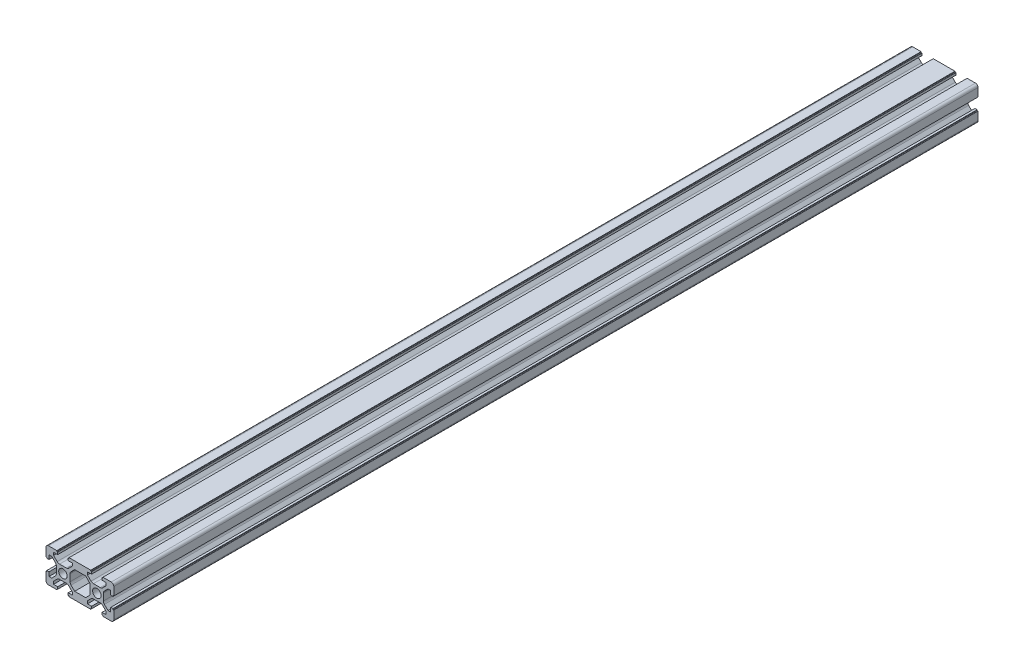
from build123d import *

# Parameters (mm, degrees)
SKETCH1_R               = 2.5
EXTRUDE1_DEPTH          = 510
CUT_EXTRUDE1_DEPTH      = 511.979451642
CUT_EXTRUDE1_DEPTH_BACK = 511.979451642
SKETCH2_W               = 3.3
SKETCH2_H               = 11.078679656


with BuildPart() as part:
    # Sketch1 → Extrude1 (new body)
    with BuildSketch(Plane.XY):
        with BuildLine():
            Line((0, 3.9), (-2.010912703, 3.9))
            ThreePointArc((-2.010912703, 3.9), (-2.776279568, 4.052240935), (-3.425126266, 4.485786438))
            Line((-3.425126266, 4.485786438), (-5.539339828, 6.6))
            Line((-5.539339828, 6.6), (-5.539339828, 8.2))
            Line((-5.539339828, 8.2), (-3.1, 8.2))
            Line((-3.1, 8.2), (-3.1, 9.5))
            Line((-3.1, 9.5), (-3.4, 9.5))
            ThreePointArc((-3.4, 9.5), (-3.541421356, 9.558578644), (-3.6, 9.7))
            Line((-3.6, 9.7), (-3.6, 10))
            Line((-3.6, 10), (-8.5, 10))
            Line((-8.5, 10), (-11.5, 10))
            Line((-11.5, 10), (-16.4, 10))
            Line((-16.4, 10), (-16.4, 9.7))
            ThreePointArc((-16.4, 9.7), (-16.458578644, 9.558578644), (-16.6, 9.5))
            Line((-16.6, 9.5), (-16.9, 9.5))
            Line((-16.9, 9.5), (-16.9, 8.2))
            Line((-16.9, 8.2), (-14.460660172, 8.2))
            Line((-14.460660172, 8.2), (-14.460660172, 6.6))
            Line((-14.460660172, 6.6), (-16.574873734, 4.485786438))
            ThreePointArc((-16.574873734, 4.485786438), (-17.223720432, 4.052240935), (-17.989087297, 3.9))
            Line((-17.989087297, 3.9), (-20, 3.9))
            Line((-20, 3.9), (-22.010912703, 3.9))
            ThreePointArc((-22.010912703, 3.9), (-22.776279568, 4.052240935), (-23.425126266, 4.485786438))
            Line((-23.425126266, 4.485786438), (-25.539339828, 6.6))
            Line((-25.539339828, 6.6), (-25.539339828, 8.2))
            Line((-25.539339828, 8.2), (-23.1, 8.2))
            Line((-23.1, 8.2), (-23.1, 9.5))
            Line((-23.1, 9.5), (-23.4, 9.5))
            ThreePointArc((-23.4, 9.5), (-23.541421356, 9.558578644), (-23.6, 9.7))
            Line((-23.6, 9.7), (-23.6, 10))
            Line((-23.6, 10), (-28.5, 10))
            ThreePointArc((-28.5, 10), (-29.560660172, 9.560660172), (-30, 8.5))
            Line((-30, 8.5), (-30, 3.6))
            Line((-30, 3.6), (-29.7, 3.6))
            ThreePointArc((-29.7, 3.6), (-29.558578644, 3.541421356), (-29.5, 3.4))
            Line((-29.5, 3.4), (-29.5, 3.1))
            Line((-29.5, 3.1), (-28.2, 3.1))
            Line((-28.2, 3.1), (-28.2, 5.539339828))
            Line((-28.2, 5.539339828), (-26.6, 5.539339828))
            Line((-26.6, 5.539339828), (-24.485786438, 3.425126266))
            ThreePointArc((-24.485786438, 3.425126266), (-24.052240935, 2.776279568), (-23.9, 2.010912703))
            Line((-23.9, 2.010912703), (-23.9, 0))
            Line((-23.9, 0), (-23.9, -2.010912703))
            ThreePointArc((-23.9, -2.010912703), (-24.052240935, -2.776279568), (-24.485786438, -3.425126266))
            Line((-24.485786438, -3.425126266), (-26.6, -5.539339828))
            Line((-26.6, -5.539339828), (-28.2, -5.539339828))
            Line((-28.2, -5.539339828), (-28.2, -3.1))
            Line((-28.2, -3.1), (-29.5, -3.1))
            Line((-29.5, -3.1), (-29.5, -3.4))
            ThreePointArc((-29.5, -3.4), (-29.558578644, -3.541421356), (-29.7, -3.6))
            Line((-29.7, -3.6), (-30, -3.6))
            Line((-30, -3.6), (-30, -8.5))
            ThreePointArc((-30, -8.5), (-29.560660172, -9.560660172), (-28.5, -10))
            Line((-28.5, -10), (-23.6, -10))
            Line((-23.6, -10), (-23.6, -9.7))
            ThreePointArc((-23.6, -9.7), (-23.541421356, -9.558578644), (-23.4, -9.5))
            Line((-23.4, -9.5), (-23.1, -9.5))
            Line((-23.1, -9.5), (-23.1, -8.2))
            Line((-23.1, -8.2), (-25.539339828, -8.2))
            Line((-25.539339828, -8.2), (-25.539339828, -6.6))
            Line((-25.539339828, -6.6), (-23.425126266, -4.485786438))
            ThreePointArc((-23.425126266, -4.485786438), (-22.776279568, -4.052240935), (-22.010912703, -3.9))
            Line((-22.010912703, -3.9), (-20, -3.9))
            Line((-20, -3.9), (-17.989087297, -3.9))
            ThreePointArc((-17.989087297, -3.9), (-17.223720432, -4.052240935), (-16.574873734, -4.485786438))
            Line((-16.574873734, -4.485786438), (-14.460660172, -6.6))
            Line((-14.460660172, -6.6), (-14.460660172, -8.2))
            Line((-14.460660172, -8.2), (-16.9, -8.2))
            Line((-16.9, -8.2), (-16.9, -9.5))
            Line((-16.9, -9.5), (-16.6, -9.5))
            ThreePointArc((-16.6, -9.5), (-16.458578644, -9.558578644), (-16.4, -9.7))
            Line((-16.4, -9.7), (-16.4, -10))
            Line((-16.4, -10), (-11.5, -10))
            Line((-11.5, -10), (-8.5, -10))
            Line((-8.5, -10), (-3.6, -10))
            Line((-3.6, -10), (-3.6, -9.7))
            ThreePointArc((-3.6, -9.7), (-3.541421356, -9.558578644), (-3.4, -9.5))
            Line((-3.4, -9.5), (-3.1, -9.5))
            Line((-3.1, -9.5), (-3.1, -8.2))
            Line((-3.1, -8.2), (-5.539339828, -8.2))
            Line((-5.539339828, -8.2), (-5.539339828, -6.6))
            Line((-5.539339828, -6.6), (-3.425126266, -4.485786438))
            ThreePointArc((-3.425126266, -4.485786438), (-2.776279568, -4.052240935), (-2.010912703, -3.9))
            Line((-2.010912703, -3.9), (0, -3.9))
            Line((0, -3.9), (2.010912703, -3.9))
            ThreePointArc((2.010912703, -3.9), (2.776279568, -4.052240935), (3.425126266, -4.485786438))
            Line((3.425126266, -4.485786438), (5.539339828, -6.6))
            Line((5.539339828, -6.6), (5.539339828, -8.2))
            Line((5.539339828, -8.2), (3.1, -8.2))
            Line((3.1, -8.2), (3.1, -9.5))
            Line((3.1, -9.5), (3.4, -9.5))
            ThreePointArc((3.4, -9.5), (3.541421356, -9.558578644), (3.6, -9.7))
            Line((3.6, -9.7), (3.6, -10))
            Line((3.6, -10), (8.5, -10))
            ThreePointArc((8.5, -10), (9.560660172, -9.560660172), (10, -8.5))
            Line((10, -8.5), (10, -3.6))
            Line((10, -3.6), (9.7, -3.6))
            ThreePointArc((9.7, -3.6), (9.558578644, -3.541421356), (9.5, -3.4))
            Line((9.5, -3.4), (9.5, -3.1))
            Line((9.5, -3.1), (8.2, -3.1))
            Line((8.2, -3.1), (8.2, -5.539339828))
            Line((8.2, -5.539339828), (6.6, -5.539339828))
            Line((6.6, -5.539339828), (4.485786438, -3.425126266))
            ThreePointArc((4.485786438, -3.425126266), (4.052240935, -2.776279568), (3.9, -2.010912703))
            Line((3.9, -2.010912703), (3.9, 0))
            Line((3.9, 0), (3.9, 2.010912703))
            ThreePointArc((3.9, 2.010912703), (4.052240935, 2.776279568), (4.485786438, 3.425126266))
            Line((4.485786438, 3.425126266), (6.6, 5.539339828))
            Line((6.6, 5.539339828), (8.2, 5.539339828))
            Line((8.2, 5.539339828), (8.2, 3.1))
            Line((8.2, 3.1), (9.5, 3.1))
            Line((9.5, 3.1), (9.5, 3.4))
            ThreePointArc((9.5, 3.4), (9.558578644, 3.541421356), (9.7, 3.6))
            Line((9.7, 3.6), (10, 3.6))
            Line((10, 3.6), (10, 8.5))
            ThreePointArc((10, 8.5), (9.560660172, 9.560660172), (8.5, 10))
            Line((8.5, 10), (3.6, 10))
            Line((3.6, 10), (3.6, 9.7))
            ThreePointArc((3.6, 9.7), (3.541421356, 9.558578644), (3.4, 9.5))
            Line((3.4, 9.5), (3.1, 9.5))
            Line((3.1, 9.5), (3.1, 8.2))
            Line((3.1, 8.2), (5.539339828, 8.2))
            Line((5.539339828, 8.2), (5.539339828, 6.6))
            Line((5.539339828, 6.6), (3.425126266, 4.485786438))
            ThreePointArc((3.425126266, 4.485786438), (2.776279568, 4.052240935), (2.010912703, 3.9))
            Line((2.010912703, 3.9), (0, 3.9))
        make_face()
        Circle(SKETCH1_R, mode=Mode.SUBTRACT)
        with Locations(Location((-20, 0, 0), (0, 0, 180))):
            Circle(SKETCH1_R, mode=Mode.SUBTRACT)
        with BuildLine():
            Line((-9.7, 3.6), (-10, 3.6))
            ThreePointArc((-10, 3.6), (-10.141421356, 3.541421356), (-10.2, 3.4))
            Line((-10.2, 3.4), (-10.2, 3.1))
            Line((-10.2, 3.1), (-11.5, 3.1))
            Line((-11.5, 3.1), (-11.5, 5.539339828))
            Line((-11.5, 5.539339828), (-13.1, 5.539339828))
            Line((-13.1, 5.539339828), (-15.214213562, 3.425126266))
            ThreePointArc((-15.214213562, 3.425126266), (-15.647759065, 2.776279568), (-15.8, 2.010912703))
            Line((-15.8, 2.010912703), (-15.8, 0))
            Line((-15.8, 0), (-15.8, -2.010912703))
            ThreePointArc((-15.8, -2.010912703), (-15.647759065, -2.776279568), (-15.214213562, -3.425126266))
            Line((-15.214213562, -3.425126266), (-13.1, -5.539339828))
            Line((-13.1, -5.539339828), (-11.5, -5.539339828))
            Line((-11.5, -5.539339828), (-11.5, -3.1))
            Line((-11.5, -3.1), (-10.2, -3.1))
            Line((-10.2, -3.1), (-10.2, -3.4))
            ThreePointArc((-10.2, -3.4), (-10.141421356, -3.541421356), (-10, -3.6))
            Line((-10, -3.6), (-9.7, -3.6))
            ThreePointArc((-9.7, -3.6), (-9.558578644, -3.541421356), (-9.5, -3.4))
            Line((-9.5, -3.4), (-9.5, -3.1))
            Line((-9.5, -3.1), (-8.2, -3.1))
            Line((-8.2, -3.1), (-8.2, -5.539339828))
            Line((-8.2, -5.539339828), (-6.6, -5.539339828))
            Line((-6.6, -5.539339828), (-4.485786438, -3.425126266))
            ThreePointArc((-4.485786438, -3.425126266), (-4.052240935, -2.776279568), (-3.9, -2.010912703))
            Line((-3.9, -2.010912703), (-3.9, 0))
            Line((-3.9, 0), (-3.9, 2.010912703))
            ThreePointArc((-3.9, 2.010912703), (-4.052240935, 2.776279568), (-4.485786438, 3.425126266))
            Line((-4.485786438, 3.425126266), (-6.6, 5.539339828))
            Line((-6.6, 5.539339828), (-8.2, 5.539339828))
            Line((-8.2, 5.539339828), (-8.2, 3.1))
            Line((-8.2, 3.1), (-9.5, 3.1))
            Line((-9.5, 3.1), (-9.5, 3.4))
            ThreePointArc((-9.5, 3.4), (-9.558578644, 3.541421356), (-9.7, 3.6))
        make_face(mode=Mode.SUBTRACT)
    extrude(amount=EXTRUDE1_DEPTH)

    # Sketch2 → Cut-Extrude1 (cut, two sides: drawn at the far end of the back side and taken through both)
    with BuildSketch(Plane.XY.offset(510).offset(-CUT_EXTRUDE1_DEPTH_BACK)):
        with Locations((-9.85, 0)):
            Rectangle(SKETCH2_W, SKETCH2_H)
    extrude(amount=CUT_EXTRUDE1_DEPTH + CUT_EXTRUDE1_DEPTH_BACK, mode=Mode.SUBTRACT)


solid = part.part
